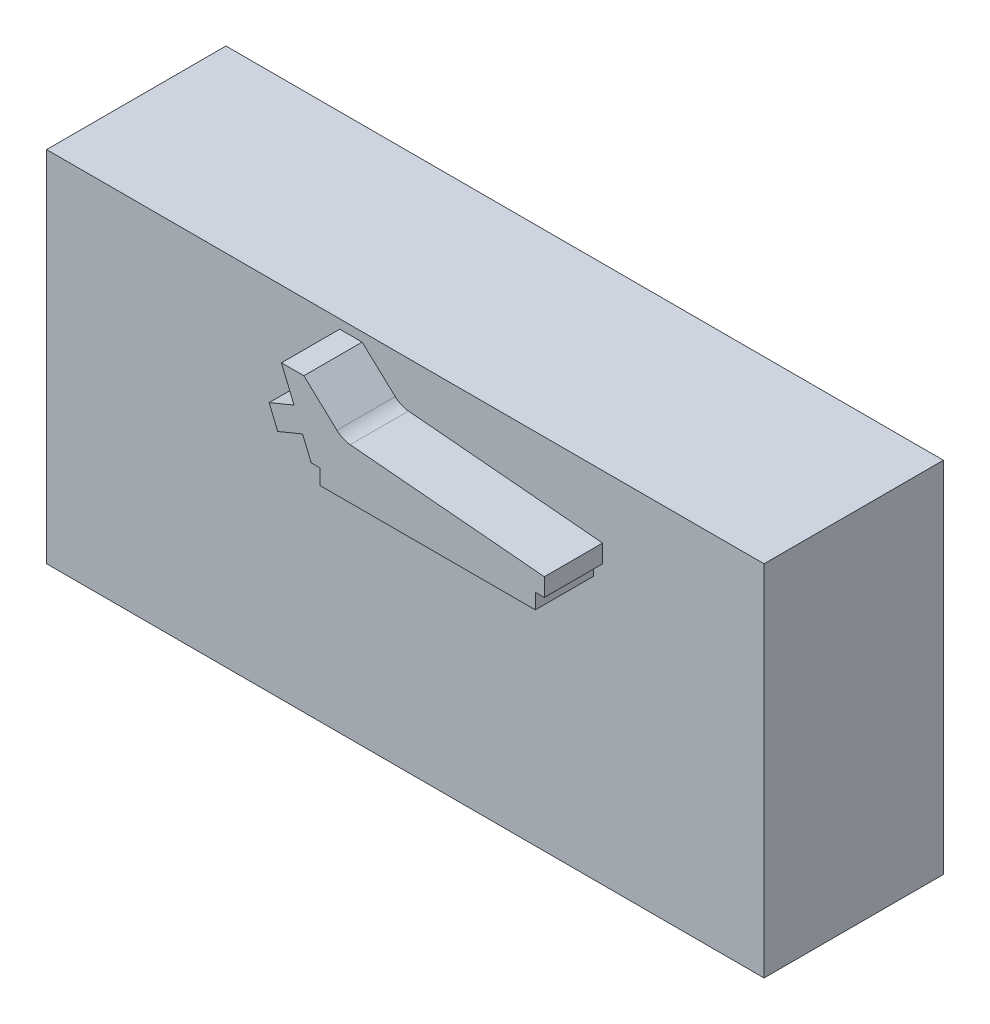
from build123d import *

# Parameters (mm, degrees)
SKETCH1_W      = 203.2
SKETCH1_H      = 101.6
EXTRUDE1_DEPTH = 50.8
EXTRUDE2_DEPTH = 16.51


with BuildPart() as part:
    # Sketch1 → Extrude1 (new body)
    with BuildSketch(Plane.XY):
        with Locations((101.6, 50.8)):
            Rectangle(SKETCH1_W, SKETCH1_H)
    extrude(amount=EXTRUDE1_DEPTH)

    # Sketch20 → Extrude2 (add)
    with BuildSketch(Plane.XY.offset(50.8)):
        with BuildLine():
            ThreePointArc((98.73765298, 90.37654578), (100.476619995, 89.229944151), (102.493050685, 88.707728828))
            Line((102.493050685, 88.707728828), (157.48, 83.82))
            Line((157.48, 83.82), (157.48, 78.74))
            Line((157.48, 78.74), (154.94, 78.74))
            Line((154.94, 78.74), (154.94, 74.422))
            Line((154.94, 74.422), (93.98, 74.422))
            Line((93.98, 74.422), (93.98, 78.74))
            Line((93.98, 78.74), (91.44, 78.74))
            Line((91.44, 78.74), (89.009960204, 84.606635031))
            Line((89.009960204, 84.606635031), (81.969998167, 81.690587277))
            Line((81.969998167, 81.690587277), (79.539958371, 87.557222308))
            Line((79.539958371, 87.557222308), (86.579920409, 90.473270063))
            Line((86.579920409, 90.473270063), (83.023180413, 99.06))
            Line((83.023180413, 99.06), (89.373180413, 99.06))
            Line((89.373180413, 99.06), (98.73765298, 90.37654578))
        make_face()
    extrude(amount=EXTRUDE2_DEPTH)


solid = part.part
